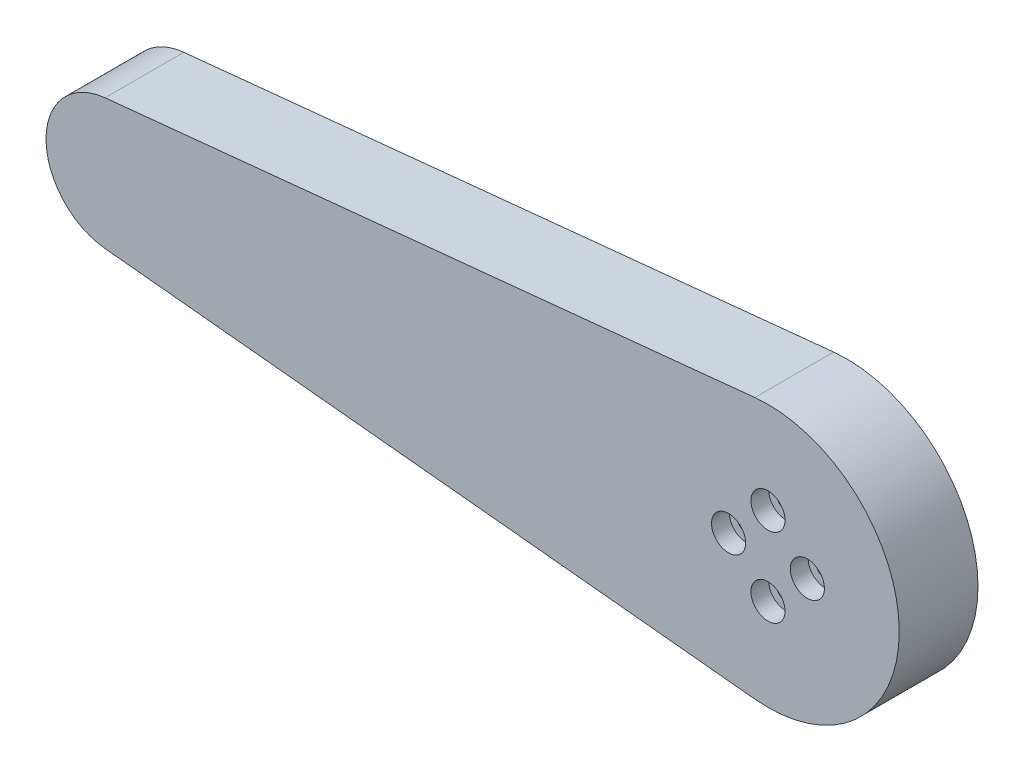
from build123d import *

# Parameters (mm, degrees)
BOSS_EXTRUDE1_DEPTH                                 = 15
CBORE_FOR_M3_HEX_SOCKET_HEAD_CAP_SCREW1_D           = 3.4
CBORE_FOR_M3_HEX_SOCKET_HEAD_CAP_SCREW1_CBORE_D     = 6.5
CBORE_FOR_M3_HEX_SOCKET_HEAD_CAP_SCREW1_CBORE_DEPTH = 3.4


with BuildPart() as part:
    # Sketch1 → Boss-Extrude1 (new body)
    with BuildSketch(Plane.XY):
        with BuildLine():
            Line((-126.25, 12.437342964), (-2.5, 24.874685928))
            ThreePointArc((-2.5, 24.874685928), (25, 0), (-2.5, -24.874685928))
            Line((-2.5, -24.874685928), (-126.25, -12.437342964))
            ThreePointArc((-126.25, -12.437342964), (-137.5, 0), (-126.25, 12.437342964))
        make_face()
    extrude(amount=BOSS_EXTRUDE1_DEPTH)

    # CBORE for M3 Hex Socket Head Cap Screw1 (through all)
    with Locations(Plane.XY.offset(15)):
        with Locations((0, 7.5), (7.5, 0), (0, -7.5), (-7.5, 0)):
            CounterBoreHole(CBORE_FOR_M3_HEX_SOCKET_HEAD_CAP_SCREW1_D / 2, CBORE_FOR_M3_HEX_SOCKET_HEAD_CAP_SCREW1_CBORE_D / 2, CBORE_FOR_M3_HEX_SOCKET_HEAD_CAP_SCREW1_CBORE_DEPTH)


solid = part.part
